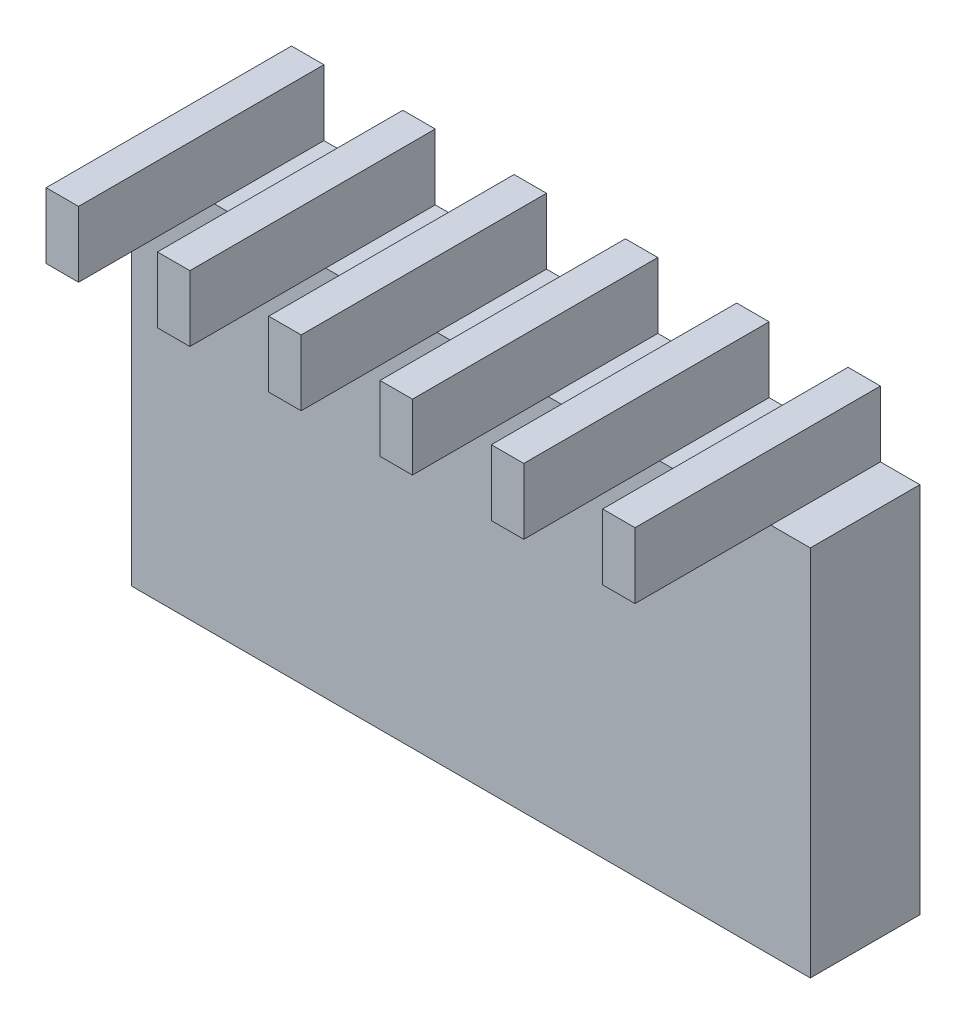
from build123d import *

# Parameters (mm, degrees)
SKETCH_1_W               = 25.9
SKETCH_1_H               = 8.5
EXTRUDE_1_DEPTH          = 2.5
SKETCH_1_5_W             = 23.6
SKETCH_1_5_H             = 1.5
EXTRUDE_2_DEPTH          = 2.5
SKETCH_2_W               = 23.6
SKETCH_2_H               = 1.5
EXTRUDE_3_DEPTH          = 3.1
SKETCH_3_W               = 1.8
SKETCH_3_H               = 5.6
CUT_EXTRUDE_1_DEPTH      = 1.5
CUT_EXTRUDE_2_DEPTH      = 2
CUT_EXTRUDE_2_DEPTH_BACK = 10
SKETCH_4_W               = 15
SKETCH_4_H               = 7.729949766


with BuildPart() as part:
    # 草图1 → 凸台-拉伸1 (new body)
    with BuildSketch(Plane.XY):
        with Locations((7.382170543, 0.04770021)):
            Rectangle(SKETCH_1_W, SKETCH_1_H)
    extrude(amount=EXTRUDE_1_DEPTH)

    # 草图1<5> → 凸台-拉伸2 (add)
    with BuildSketch(Plane.XY):
        with Locations((7.382170543, 5.04770021)):
            Rectangle(SKETCH_1_5_W, SKETCH_1_5_H)
    extrude(amount=EXTRUDE_2_DEPTH)

    # 草图2 → 凸台-拉伸3 (add)
    with BuildSketch(Plane.XY.offset(2.5)):
        with Locations((7.382170543, 5.04770021)):
            Rectangle(SKETCH_2_W, SKETCH_2_H)
    extrude(amount=EXTRUDE_3_DEPTH)

    # 草图3 → 切除-拉伸1 (cut)
    with BuildSketch(Plane(origin=(0, 5.79770021, 0), x_dir=(1, 0, 0), z_dir=(0, 1, 0))):
        with Locations((17.542170543, -2.8)):
            Rectangle(SKETCH_3_W, SKETCH_3_H)
        with Locations((15.002170543, -2.8)):
            Rectangle(SKETCH_3_W, SKETCH_3_H)
        with Locations((12.462170543, -2.8)):
            Rectangle(SKETCH_3_W, SKETCH_3_H)
        with Locations((9.922170543, -2.8)):
            Rectangle(SKETCH_3_W, SKETCH_3_H)
        with Locations((7.382170543, -2.8)):
            Rectangle(SKETCH_3_W, SKETCH_3_H)
        with Locations((4.842170543, -2.8)):
            Rectangle(SKETCH_3_W, SKETCH_3_H)
        with Locations((2.302170543, -2.8)):
            Rectangle(SKETCH_3_W, SKETCH_3_H)
        with Locations((-0.237829457, -2.8)):
            Rectangle(SKETCH_3_W, SKETCH_3_H)
        with Locations((-2.777829457, -2.8)):
            Rectangle(SKETCH_3_W, SKETCH_3_H)
    extrude(amount=-CUT_EXTRUDE_1_DEPTH, mode=Mode.SUBTRACT)

    # 草图4 → 切除-拉伸2 (cut, two sides: drawn at the far end of the back side and taken through both)
    with BuildSketch(Plane(origin=(0, 4.29770021, 0), x_dir=(1, 0, 0), z_dir=(0, 1, 0)).offset(-CUT_EXTRUDE_2_DEPTH_BACK)):
        with Locations((17.422170543, -2.378366376)):
            Rectangle(SKETCH_4_W, SKETCH_4_H)
    extrude(amount=CUT_EXTRUDE_2_DEPTH + CUT_EXTRUDE_2_DEPTH_BACK, mode=Mode.SUBTRACT)


solid = part.part
